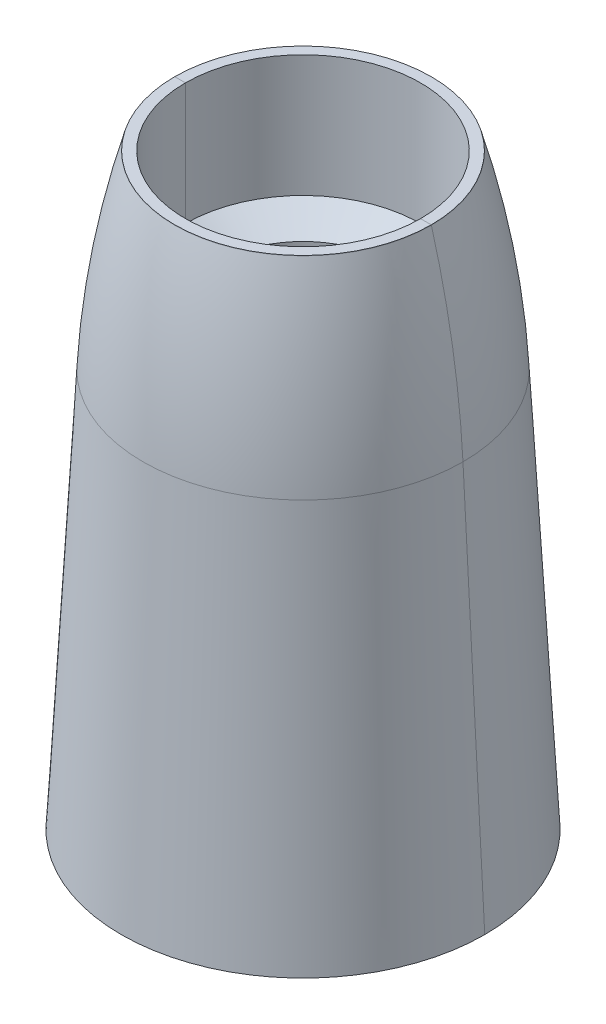
from build123d import *

# Parameters (mm, degrees)
FILLET1_R = 40.5


with BuildPart() as part:
    # Sketch1 → Revolve1 (revolve)
    with BuildSketch(Plane(origin=(0, 0, 0), x_dir=(0, 0, -1), z_dir=(1, 0, 0))):
        Polygon((2.6, 0), (8.5, 0), (7.235571744, 23.145355256), (6, 27.5), (5.5, 27.5), (5.5, 21.8), (4, 21), (4, 14.5), (5.5, 13.7), (5.5, 8), (2.6, 8), align=None)
    revolve(axis=Axis((0, 0, 0), (0, 1, 0)))

    # Fillet1
    fillet1_edges = [part.edges().sort_by_distance(p)[0] for p in [
        (0, 23.145355256, 7.235571744),
    ]]
    fillet(fillet1_edges, radius=FILLET1_R)


with BuildPart() as body_2:
    # Split1: the piece on the far side of the plane
    add(part.part)
    split(bisect_by=Plane.XY, keep=Keep.BOTTOM)


with BuildPart() as part_1:
    add(part.part)

    # Split1
    split(bisect_by=Plane.XY, keep=Keep.TOP)


solid = Compound([body_2.part, part_1.part])
